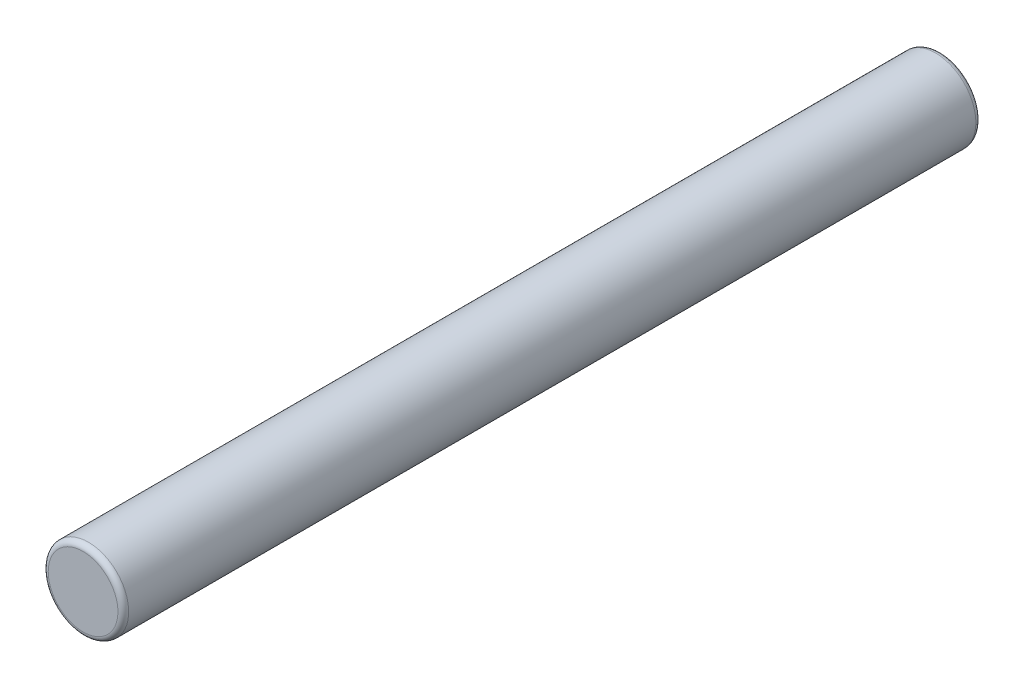
from build123d import *


with BuildPart() as part:
    # Esboço1 → Revolução1 (revolve)
    with BuildSketch(Plane.XZ, mode=Mode.PRIVATE) as revolu_o1_sk:
        with BuildLine():
            Line((1.3, 16), (0, 16))
            Line((0, 16), (0, -16))
            Line((0, -16), (1.3, -16))
            ThreePointArc((1.3, -16), (1.441421356, -15.941421356), (1.5, -15.8))
            Line((1.5, -15.8), (1.5, 15.8))
            ThreePointArc((1.5, 15.8), (1.441421356, 15.941421356), (1.3, 16))
        make_face()
    revolve(revolu_o1_sk.sketch.rotate(Axis((0, 0, 16), (0, 0, -1)), 180), axis=Axis((0, 0, 16), (0, 0, -1)))


solid = part.part
